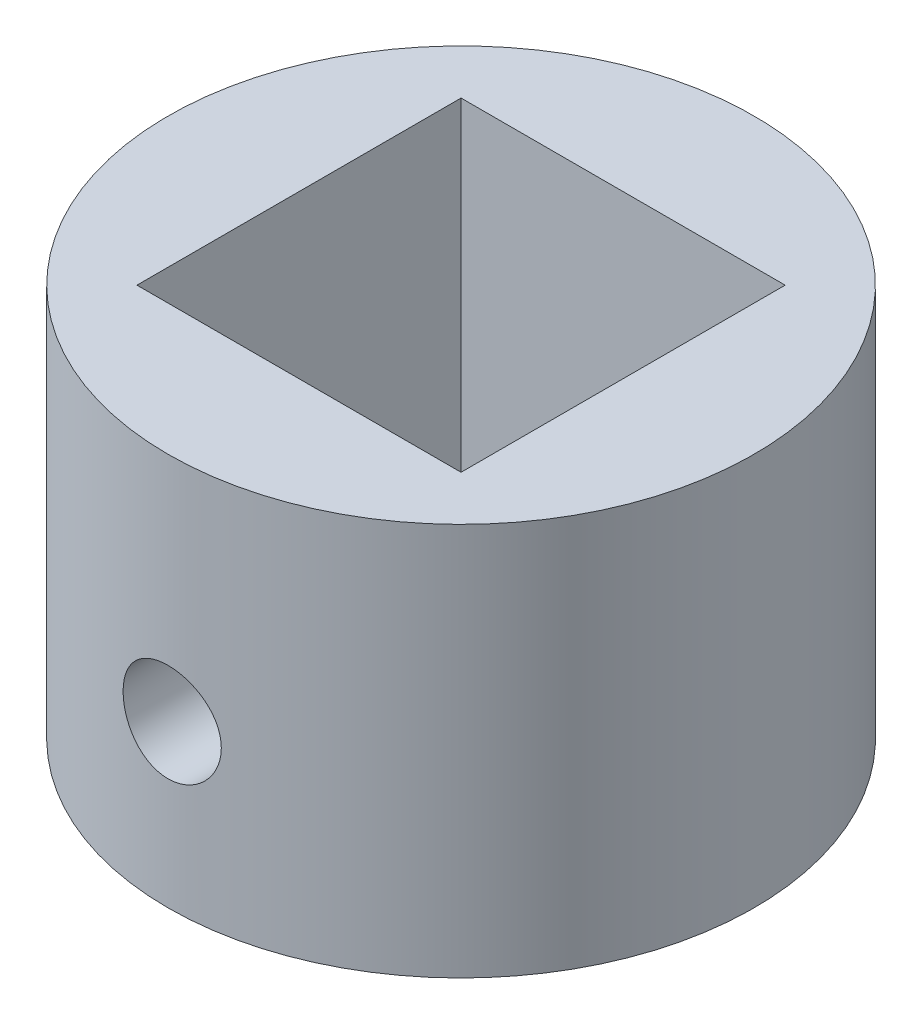
from build123d import *

# Parameters (mm, degrees)
SKETCH1_R               = 8.95
SKETCH1_W               = 9.9
SKETCH1_H               = 9.9
BOSS_EXTRUDE1_DEPTH     = 12
CUT_EXTRUDE2_DEPTH      = 18.441473562
CUT_EXTRUDE2_DEPTH_BACK = 18.441473562
SKETCH4_R               = 1.5


with BuildPart() as part:
    # Sketch1 → Boss-Extrude1 (new body)
    with BuildSketch(Plane(origin=(0, 0, 0), x_dir=(1, 0, 0), z_dir=(0, 1, 0))):
        with Locations(Location((0, 0, 0), (0, 0, 270))):
            Circle(SKETCH1_R)
        Rectangle(SKETCH1_W, SKETCH1_H, mode=Mode.SUBTRACT)
    extrude(amount=BOSS_EXTRUDE1_DEPTH)

    # Sketch4 → Cut-Extrude2 (cut, two sides: drawn at the far end of the back side and taken through both)
    with BuildSketch(Plane.XY.offset(-CUT_EXTRUDE2_DEPTH_BACK)):
        with Locations((0, 4.916404418)):
            Circle(SKETCH4_R)
    extrude(amount=CUT_EXTRUDE2_DEPTH + CUT_EXTRUDE2_DEPTH_BACK, mode=Mode.SUBTRACT)


solid = part.part
